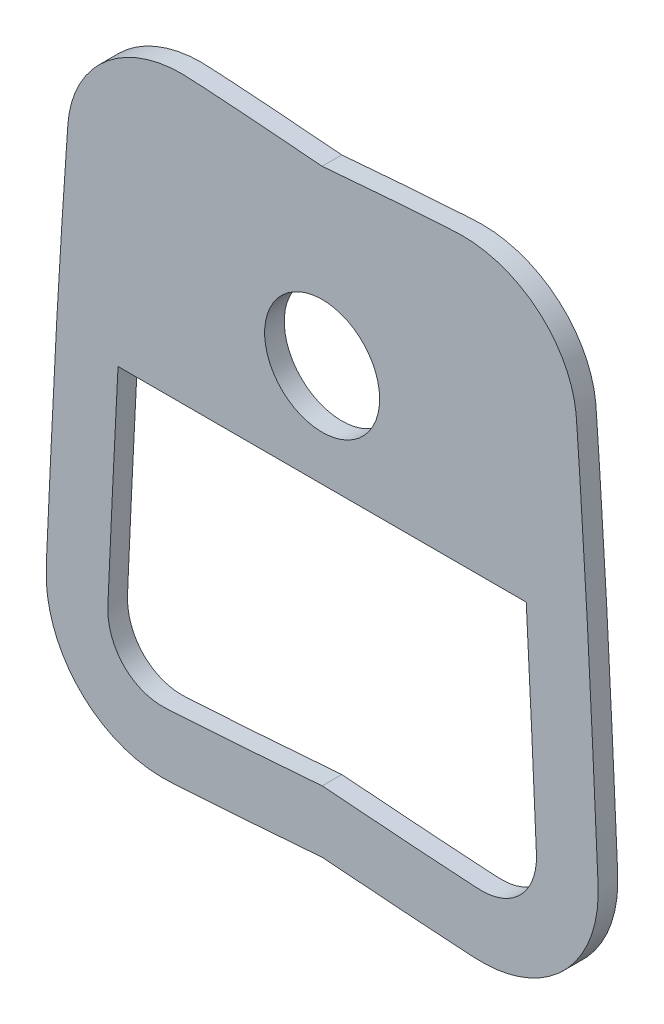
from build123d import *

# Parameters (mm, degrees)
SKETCH_2_R      = 8.2
EXTRUDE_2_DEPTH = 1.4


with BuildPart() as part:
    # Эскиз2 → Бобышка-Вытянуть2 (new, symmetric)
    # profile 1 of 2: a face of its own
    with BuildSketch(Plane.XY):
        with BuildLine():
            add(Edge.make_bspline(
                [(-6.106e-06, 42.936758799), (3.066982431, 42.69589122), (7.667054461, 42.340675838), (13.807922647, 41.917817531), (17.642241665, 41.657603706), (20.332000638, 41.494442439), (21.867191585, 41.389474615), (23.493874205, 41.36446887), (25.49792944, 41.545773472), (28.65572376, 42.295351817), (32.33082765, 44.08578525), (35.913122537, 47.447474533), (38.351744943, 51.696943442), (39.206421898, 55.263330712), (39.372141445, 57.666150957), (39.364073579, 59.290866654), (39.209703941, 61.94105737), (39.055904029, 65.80233233), (38.838607379, 70.403282742), (38.625156094, 75.012869346), (38.40464593, 79.620265047), (38.099521772, 85.764845578), (37.684907095, 93.44479904), (37.218252645, 101.121711973), (36.870905357, 106.493172013), (36.665115977, 109.563169876), (36.510546717, 111.862843037), (36.369562657, 113.787472083), (36.277323718, 115.308026818), (36.0967333, 116.94493218), (35.611205933, 118.913784107), (34.338035736, 121.919614544), (31.881306502, 125.208648153), (28.552663628, 127.593433781), (25.571172345, 128.85864421), (23.218372373, 129.47569751), (20.812794528, 129.768910143), (18.387321521, 129.673960558), (16.120916127, 129.512030625), (13.038679622, 129.31251306), (9.206577138, 129.040287683), (4.600580831, 128.687163818), (1.533542046, 128.425300032), (0.000188966, 128.290499212)],
                knots=[0.000425285, 0.000425285, 0.000425285, 0.000425285, 0.062868868, 0.094090659, 0.12531245, 0.140923346, 0.148728794, 0.156534242, 0.172145137, 0.187756033, 0.218977824, 0.250199616, 0.281421407, 0.312643198, 0.320448646, 0.328254094, 0.34386499, 0.375086781, 0.406308572, 0.437530364, 0.468752155, 0.499973946, 0.562417529, 0.624861112, 0.656082903, 0.671693799, 0.687304694, 0.70291559, 0.710721038, 0.718526486, 0.734137381, 0.749748277, 0.780970068, 0.812191859, 0.827802755, 0.843413651, 0.859024546, 0.874635442, 0.890246338, 0.905857233, 0.937079025, 0.968300816, 0.999522607, 0.999522607, 0.999522607, 0.999522607], degree=3))
            add(Edge.make_bspline(
                [(0.000188966, 128.290499212), (-1.533148577, 128.426024505), (-4.600513172, 128.686786624), (-9.206008423, 129.040494293), (-13.038976229, 129.312068159), (-16.119280154, 129.512656226), (-18.390289794, 129.672108285), (-20.810681816, 129.769442416), (-23.218277521, 129.475462465), (-25.566177473, 128.860842912), (-28.550161685, 127.594772364), (-31.882491642, 125.207939875), (-34.339372862, 121.917717515), (-35.61187086, 118.910964713), (-36.097505691, 116.941536317), (-36.276844114, 115.304223221), (-36.369865404, 113.784554376), (-36.510634639, 111.859698384), (-36.665216299, 109.560355692), (-36.871153275, 106.490332981), (-37.21843875, 101.119136808), (-37.684884958, 93.442405211), (-38.099806554, 85.762617798), (-38.404533837, 79.618352367), (-38.625329532, 75.011083678), (-38.838823393, 70.401759123), (-39.055348746, 65.800306167), (-39.211663435, 61.941414735), (-39.361831703, 59.287626957), (-39.372884549, 57.663831269), (-39.205194254, 55.263613326), (-38.351837032, 51.696149976), (-35.912378094, 47.446672881), (-32.330542757, 44.085572045), (-28.65301377, 42.294640213), (-25.498977621, 41.54606377), (-23.489492777, 41.363842686), (-21.871123683, 41.390465857), (-20.329526529, 41.494103912), (-17.642964593, 41.657789928), (-13.807155203, 41.917788551), (-7.666874452, 42.340710092), (-3.06687189, 42.695947769), (-6.106e-06, 42.936758799)],
                knots=[0.000477404, 0.000477404, 0.000477404, 0.000477404, 0.031699194, 0.062920985, 0.094142776, 0.109753671, 0.125364566, 0.140975461, 0.156586357, 0.172197252, 0.187808147, 0.219029938, 0.250251728, 0.265862623, 0.281473519, 0.289278966, 0.297084414, 0.312695309, 0.328306205, 0.3439171, 0.37513889, 0.437582471, 0.500026053, 0.531247843, 0.562469634, 0.593691424, 0.624913215, 0.656135005, 0.6717459, 0.679551348, 0.687356796, 0.718578586, 0.749800377, 0.781022167, 0.812243958, 0.827854853, 0.843465748, 0.851271196, 0.859076644, 0.874687539, 0.905909329, 0.93713112, 0.999574701, 0.999574701, 0.999574701, 0.999574701], degree=3))
        make_face()
        with BuildLine():
            add(Edge.make_bspline(
                [(-0.001891399, 119.456374051), (-0.769802725, 119.524249467), (-2.311762646, 119.661536419), (-5.347339978, 119.915249648), (-8.41322713, 120.155237102), (-11.473099489, 120.378431864), (-13.772617646, 120.538981858), (-15.694193729, 120.667766779), (-17.040091805, 120.756180419), (-17.806703431, 120.805650321), (-18.376865212, 120.842045776), (-18.862290132, 120.872095022), (-19.27274624, 120.898973628), (-19.477929057, 120.911418107), (-19.627799085, 120.918204545), (-19.836834133, 120.924389511), (-20.190866641, 120.925416198), (-20.702276867, 120.900861803), (-21.495463878, 120.806301933), (-22.465799961, 120.5842092), (-23.910333974, 120.024458819), (-25.167476203, 119.175627934), (-26.148886463, 118.115058954), (-26.738939159, 117.231981453), (-27.096781076, 116.449296531), (-27.302197786, 115.797371693), (-27.392752092, 115.401138799), (-27.443055577, 115.093611288), (-27.465867442, 114.92142911), (-27.47739958, 114.817410349), (-27.487951259, 114.699723815), (-27.512748526, 114.368068346), (-27.545276769, 113.897995474), (-27.587071186, 113.300729737), (-27.640538454, 112.538995818), (-27.70742616, 111.571662651), (-27.786853379, 110.415957405), (-27.891794448, 108.873586493), (-28.072556034, 106.176457405), (-28.322704941, 102.320501361), (-28.610551535, 97.694361081), (-28.850079691, 93.643314916), (-29.035237957, 90.362047682), (-29.203610619, 87.27857259), (-29.475742133, 82.080951301), (-29.764806342, 76.095123315), (-30.017661514, 70.676347206), (-30.1601035, 67.578642702), (-30.266151242, 65.254980035), (-30.353784845, 63.31877927), (-30.423480768, 61.769412483), (-30.47580148, 60.606782025), (-30.518451136, 59.641646532), (-30.553926029, 58.862564229), (-30.568415051, 58.438139564), (-30.569509834, 58.174184883), (-30.56000532, 57.862544463), (-30.538741906, 57.532576217), (-30.498977027, 57.126726876), (-30.423305959, 56.623218749), (-30.24782974, 55.833587464), (-29.928958163, 54.88713893), (-29.401167861, 53.84412846), (-28.740225716, 52.910266309), (-27.957425937, 52.094822698), (-27.066450007, 51.411127668), (-26.080114489, 50.866175594), (-24.997515722, 50.466978175), (-24.06962473, 50.269920953), (-23.258724108, 50.191014241), (-22.784936198, 50.177149579), (-22.323987514, 50.18762802), (-21.977243313, 50.20589858), (-21.326775473, 50.246712444), (-20.598611137, 50.290681422), (-19.623689122, 50.352688019), (-18.099073335, 50.451288417), (-16.162682357, 50.580196092), (-13.07822364, 50.786801152), (-9.243932938, 51.055528313), (-4.629119147, 51.400982976), (-1.542035569, 51.642763909), (6.1095e-05, 51.763850706)],
                knots=[-0.004774234, -0.004774234, -0.004774234, -0.004774234, 0.010991817, 0.026757868, 0.05828997, 0.07405602, 0.089822071, 0.105588122, 0.113471148, 0.11741266, 0.121354173, 0.125295686, 0.127266442, 0.129237199, 0.131207955, 0.133178711, 0.137120224, 0.14500325, 0.152886275, 0.168652326, 0.184418377, 0.215950479, 0.23171653, 0.247482581, 0.263248631, 0.271131657, 0.279014682, 0.282956195, 0.284926951, 0.286897708, 0.288868464, 0.290839221, 0.294780733, 0.298722246, 0.302663759, 0.310546784, 0.31842981, 0.326312835, 0.342078886, 0.373610988, 0.40514309, 0.436675191, 0.456499045, 0.472265096, 0.499739395, 0.562803599, 0.594335701, 0.610101752, 0.625867802, 0.641633853, 0.649516879, 0.657399904, 0.66528293, 0.669224442, 0.673165955, 0.677107468, 0.681048981, 0.684990493, 0.688932006, 0.696815032, 0.704698057, 0.720464108, 0.736230159, 0.75199621, 0.767762261, 0.783528312, 0.799294363, 0.815060413, 0.830826464, 0.83870949, 0.846592515, 0.850534028, 0.854475541, 0.858417053, 0.862358566, 0.870241592, 0.878124617, 0.893890668, 0.909656719, 0.941188821, 0.972720923, 1.004253024, 1.004253024, 1.004253024, 1.004253024], degree=3))
            add(Edge.make_bspline(
                [(6.1095e-05, 51.763850706), (1.542179085, 51.642738608), (4.62964406, 51.400999317), (9.243031604, 51.05548845), (13.080040302, 50.786807875), (16.163502442, 50.580094718), (18.096810488, 50.45158323), (19.628877202, 50.352297839), (20.586913412, 50.291795613), (21.253968026, 50.250653808), (21.631438663, 50.227822708), (21.925605283, 50.210156736), (22.190107743, 50.194480057), (22.338813289, 50.187345783), (22.486952489, 50.182837405), (22.816682437, 50.178277694), (23.268862023, 50.191640913), (24.064160305, 50.269504215), (25.000330078, 50.467260553), (26.079923496, 50.866323505), (27.068838901, 51.412447029), (27.9573951, 52.094863927), (28.740743275, 52.91077379), (29.401381468, 53.845037427), (29.929811962, 54.888541052), (30.247888959, 55.834365738), (30.423305073, 56.622836764), (30.514207303, 57.229644602), (30.556015154, 57.740545084), (30.569235119, 58.17570275), (30.568652112, 58.438241664), (30.563388443, 58.621065881), (30.552949075, 58.872837456), (30.540353327, 59.161162945), (30.51510185, 59.727398958), (30.457367698, 61.006403632), (30.371635272, 62.928716515), (30.265940041, 65.257791544), (30.160109197, 67.57994211), (30.01756212, 70.677806242), (29.76460672, 76.097601911), (29.475802182, 82.080900714), (29.20342172, 87.279309725), (29.035191913, 90.363029165), (28.850126585, 93.64464838), (28.610258072, 97.696677167), (28.322541503, 102.323504184), (28.072312126, 106.179064599), (27.891647066, 108.877072866), (27.786778775, 110.418764444), (27.707356313, 111.574205507), (27.640329809, 112.539187377), (27.586474189, 113.312598255), (27.553276805, 113.786616118), (27.525581388, 114.172903237), (27.496142298, 114.605755158), (27.47929798, 114.808810752), (27.449567342, 115.055705739), (27.394308745, 115.392040643), (27.300005021, 115.806635144), (27.098381073, 116.443812302), (26.737205425, 117.23586383), (26.149693006, 118.114096828), (25.166948389, 119.176028256), (23.914119896, 120.023051344), (22.467179505, 120.583005694), (21.497084254, 120.806487115), (20.699237558, 120.900783802), (20.201015068, 120.925496733), (19.780022899, 120.923700519), (19.476623789, 120.912949098), (19.017933712, 120.88378656), (18.163025528, 120.826700893), (17.243134849, 120.769930566), (16.073956741, 120.692592686), (14.927293306, 120.616495743), (13.389510147, 120.512146056), (11.473370861, 120.378465513), (8.414049665, 120.155225244), (5.342837407, 119.915452182), (2.31638884, 119.661203443), (0.767910071, 119.524051124), (-0.001891399, 119.456374051)],
                knots=[-0.004252886, -0.004252886, -0.004252886, -0.004252886, 0.027279207, 0.058811299, 0.090343392, 0.106109438, 0.121875484, 0.129758507, 0.13764153, 0.141583042, 0.143553798, 0.145524553, 0.147495309, 0.149466065, 0.151436821, 0.153407577, 0.1612906, 0.169173623, 0.184939669, 0.200705715, 0.216471762, 0.232237808, 0.248003854, 0.2637699, 0.279535946, 0.295301993, 0.303185016, 0.311068039, 0.318951062, 0.322892574, 0.326834085, 0.328804841, 0.330775597, 0.332746353, 0.334717108, 0.342600131, 0.358366178, 0.374132224, 0.38989827, 0.405664316, 0.437196409, 0.500260594, 0.527717382, 0.543483428, 0.563324779, 0.594856871, 0.626388964, 0.657921056, 0.673687102, 0.681570125, 0.689453149, 0.697336172, 0.701277683, 0.705219195, 0.707189951, 0.709160706, 0.713102218, 0.717043729, 0.720985241, 0.728868264, 0.736751287, 0.752517334, 0.76828338, 0.784049426, 0.815581518, 0.831347565, 0.847113611, 0.854996634, 0.862879657, 0.866821169, 0.87076268, 0.874704192, 0.878645703, 0.886528727, 0.89441175, 0.902294773, 0.910177796, 0.925943842, 0.941709888, 0.973241981, 0.989008027, 1.004774073, 1.004774073, 1.004774073, 1.004774073], degree=3))
        make_face(mode=Mode.SUBTRACT)
    # profile 2 of 2: a face of its own
    with BuildSketch(Plane.XY):
        with BuildLine():
            add(Edge.make_bspline(
                [(-0.001891399, 119.456374051), (-0.769802725, 119.524249467), (-2.311762646, 119.661536419), (-5.347339978, 119.915249648), (-8.41322713, 120.155237102), (-11.473099489, 120.378431864), (-13.772617646, 120.538981858), (-15.694193729, 120.667766779), (-17.040091805, 120.756180419), (-17.806703431, 120.805650321), (-18.376865212, 120.842045776), (-18.862290132, 120.872095022), (-19.27274624, 120.898973628), (-19.477929057, 120.911418107), (-19.627799085, 120.918204545), (-19.836834133, 120.924389511), (-20.190866641, 120.925416198), (-20.702276867, 120.900861803), (-21.495463878, 120.806301933), (-22.465799961, 120.5842092), (-23.910333974, 120.024458819), (-25.167476203, 119.175627934), (-26.148886463, 118.115058954), (-26.738939159, 117.231981453), (-27.096781076, 116.449296531), (-27.302197786, 115.797371693), (-27.392752092, 115.401138799), (-27.443055577, 115.093611288), (-27.465867442, 114.92142911), (-27.47739958, 114.817410349), (-27.487951259, 114.699723815), (-27.512748526, 114.368068346), (-27.545276769, 113.897995474), (-27.587071186, 113.300729737), (-27.640538454, 112.538995818), (-27.70742616, 111.571662651), (-27.786853379, 110.415957405), (-27.891794448, 108.873586493), (-28.072556034, 106.176457405), (-28.322704941, 102.320501361), (-28.610551535, 97.694361081), (-28.850079691, 93.643314916), (-29.013492372, 90.747410317), (-29.088010065, 89.392759933), (-29.109055063, 89.007333878)],
                knots=[-0.004774234, -0.004774234, -0.004774234, -0.004774234, 0.010991817, 0.026757868, 0.05828997, 0.07405602, 0.089822071, 0.105588122, 0.113471148, 0.11741266, 0.121354173, 0.125295686, 0.127266442, 0.129237199, 0.131207955, 0.133178711, 0.137120224, 0.14500325, 0.152886275, 0.168652326, 0.184418377, 0.215950479, 0.23171653, 0.247482581, 0.263248631, 0.271131657, 0.279014682, 0.282956195, 0.284926951, 0.286897708, 0.288868464, 0.290839221, 0.294780733, 0.298722246, 0.302663759, 0.310546784, 0.31842981, 0.326312835, 0.342078886, 0.373610988, 0.40514309, 0.436675191, 0.456499045, 0.46438207, 0.46438207, 0.46438207, 0.46438207], degree=3))
            Line((-29.109055063, 89.007333878), (29.108996428, 89.007333878))
            add(Edge.make_bspline(
                [(29.108996428, 89.007333878), (29.0879656, 89.392788884), (29.013462909, 90.748332663), (28.850126585, 93.64464838), (28.610258072, 97.696677167), (28.322541503, 102.323504184), (28.072312126, 106.179064599), (27.891647066, 108.877072866), (27.786778775, 110.418764444), (27.707356313, 111.574205507), (27.640329809, 112.539187377), (27.586474189, 113.312598255), (27.553276805, 113.786616118), (27.525581388, 114.172903237), (27.496142298, 114.605755158), (27.47929798, 114.808810752), (27.449567342, 115.055705739), (27.394308745, 115.392040643), (27.300005021, 115.806635144), (27.098381073, 116.443812302), (26.737205425, 117.23586383), (26.149693006, 118.114096828), (25.166948389, 119.176028256), (23.914119896, 120.023051344), (22.467179505, 120.583005694), (21.497084254, 120.806487115), (20.699237558, 120.900783802), (20.201015068, 120.925496733), (19.780022899, 120.923700519), (19.476623789, 120.912949098), (19.017933712, 120.88378656), (18.163025528, 120.826700893), (17.243134849, 120.769930566), (16.073956741, 120.692592686), (14.927293306, 120.616495743), (13.389510147, 120.512146056), (11.473370861, 120.378465513), (8.414049665, 120.155225244), (5.342837407, 119.915452182), (2.31638884, 119.661203443), (0.767910071, 119.524051124), (-0.001891399, 119.456374051)],
                knots=[0.535600405, 0.535600405, 0.535600405, 0.535600405, 0.543483428, 0.563324779, 0.594856871, 0.626388964, 0.657921056, 0.673687102, 0.681570125, 0.689453149, 0.697336172, 0.701277683, 0.705219195, 0.707189951, 0.709160706, 0.713102218, 0.717043729, 0.720985241, 0.728868264, 0.736751287, 0.752517334, 0.76828338, 0.784049426, 0.815581518, 0.831347565, 0.847113611, 0.854996634, 0.862879657, 0.866821169, 0.87076268, 0.874704192, 0.878645703, 0.886528727, 0.89441175, 0.902294773, 0.910177796, 0.925943842, 0.941709888, 0.973241981, 0.989008027, 1.004774073, 1.004774073, 1.004774073, 1.004774073], degree=3))
        make_face()
        with Locations((0, 103.636945021)):
            Circle(SKETCH_2_R, mode=Mode.SUBTRACT)
    extrude(amount=EXTRUDE_2_DEPTH, both=True)


solid = part.part
